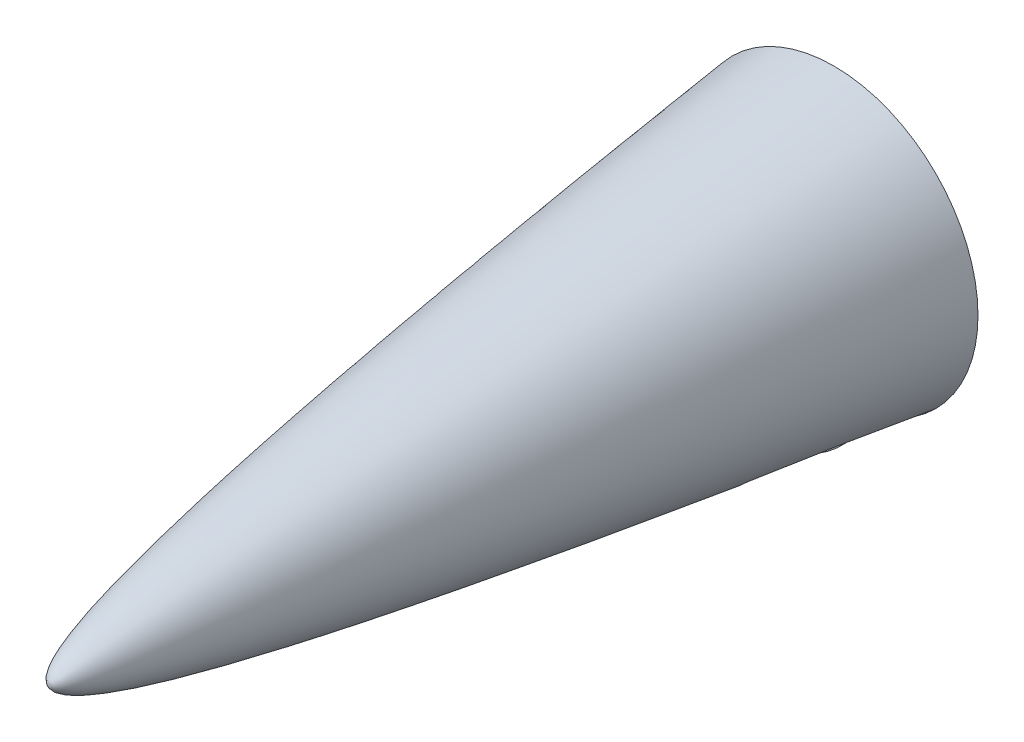
from build123d import *


with BuildPart() as part:
    # Sketch1 → Revolve1 (revolve)
    with BuildSketch(Plane(origin=(0, 0, 0), x_dir=(0, 0, -1), z_dir=(1, 0, 0))):
        with BuildLine():
            Line((0, 76.2), (0, 0))
            Line((0, 0), (-415.233681196, 0))
            add(Edge.make_bspline(
                [(-415.233681196, 0), (-415.248062264, 0.245823644), (-415.233560109, 0.571752871), (-415.15602847, 0.986644913), (-414.973845994, 1.508356885), (-414.783739874, 1.917661747), (-414.502526008, 2.391667141), (-414.087573943, 2.952607226), (-413.476263804, 3.629145422), (-412.519316919, 4.49690504), (-410.948525287, 5.660235809), (-408.140588363, 7.339222542), (-404.080568878, 9.263666606), (-398.933724011, 11.294958603), (-392.988662491, 13.324339818), (-386.94792979, 15.178832728), (-379.307853219, 17.33473262), (-369.0680124, 19.970308522), (-356.230536874, 22.964413636), (-340.785855575, 26.249852558), (-324.298179627, 29.499885464), (-303.643520133, 33.329932722), (-278.806675087, 37.633873445), (-249.776416829, 42.345905283), (-216.554008293, 47.421566585), (-187.448805801, 51.655994221), (-162.491880238, 55.166213028), (-141.673794254, 58.024462862), (-125.034058809, 60.271264563), (-108.34960752, 62.488735474), (-91.733078085, 64.665875642), (-74.985901204, 66.829342088), (-60.535935204, 68.673452271), (-47.81732924, 70.278733617), (-37.738047263, 71.542936979), (-28.780942547, 72.657441879), (-19.589439214, 73.798853105), (-9.539027298, 75.033680844), (-3.795555289, 75.736942006), (0, 76.2)],
                knots=[0, 0, 0, 0, 0, 0.002093081, 0.002794469, 0.003590279, 0.004722888, 0.005949959, 0.007504869, 0.00955412, 0.012516731, 0.016991585, 0.024212701, 0.037520729, 0.050930518, 0.064340307, 0.077976729, 0.091613151, 0.118885996, 0.154852329, 0.190818663, 0.226785003, 0.262751343, 0.334684021, 0.4066167, 0.478549379, 0.550482058, 0.586448398, 0.622414737, 0.658381077, 0.694347416, 0.730313756, 0.766280096, 0.802246435, 0.820229605, 0.838212775, 0.856195945, 0.874179114, 0.910145454, 0.910145454, 0.910145454, 0.910145454, 0.910145454], degree=4))
        make_face()
    revolve(axis=Axis((0, 0, 0), (0, 0, 1)))


solid = part.part
